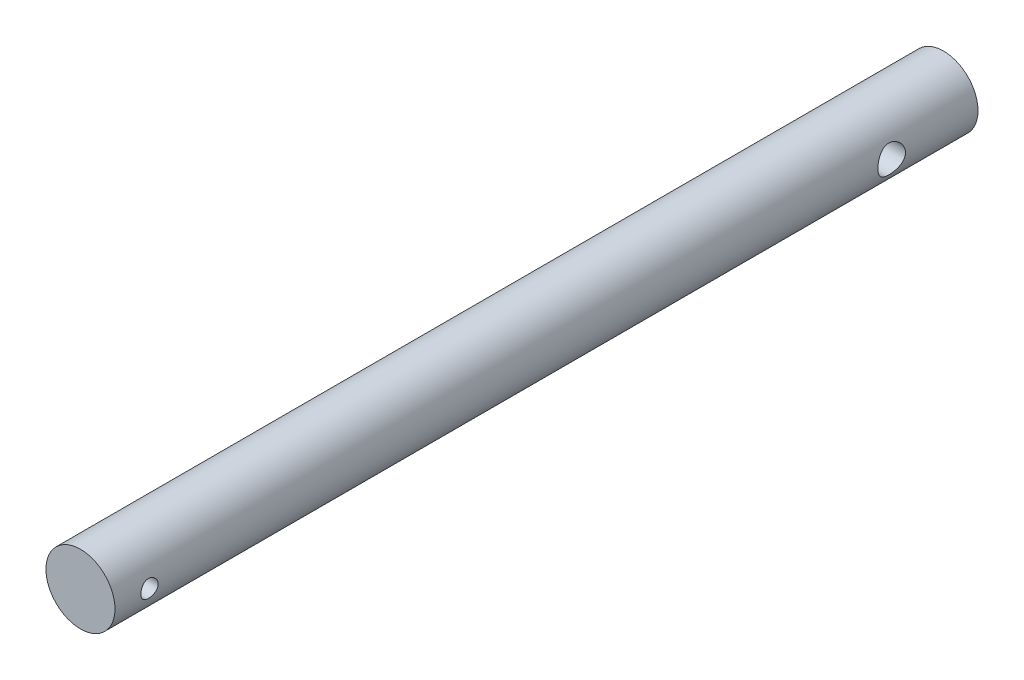
from build123d import *

# Parameters (mm, degrees)
SKETCH1_R               = 10
BOSS_EXTRUDE1_DEPTH     = 250
CUT_EXTRUDE1_DEPTH      = 251.399680511
CUT_EXTRUDE1_DEPTH_BACK = 251.399680511
SKETCH2_R               = 2.5
SKETCH2_R_2             = 4


with BuildPart() as part:
    # Sketch1 → Boss-Extrude1 (new body)
    with BuildSketch(Plane.XY):
        Circle(SKETCH1_R)
    extrude(amount=BOSS_EXTRUDE1_DEPTH)

    # Sketch2 → Cut-Extrude1 (cut, two sides: drawn at the far end of the back side and taken through both)
    with BuildSketch(Plane(origin=(0, 0, 0), x_dir=(0, 0, -1), z_dir=(1, 0, 0)).offset(-CUT_EXTRUDE1_DEPTH_BACK)):
        with Locations((-240, 0)):
            Circle(SKETCH2_R)
        with Locations((-25, 0)):
            Circle(SKETCH2_R_2)
    extrude(amount=CUT_EXTRUDE1_DEPTH + CUT_EXTRUDE1_DEPTH_BACK, mode=Mode.SUBTRACT)


solid = part.part
